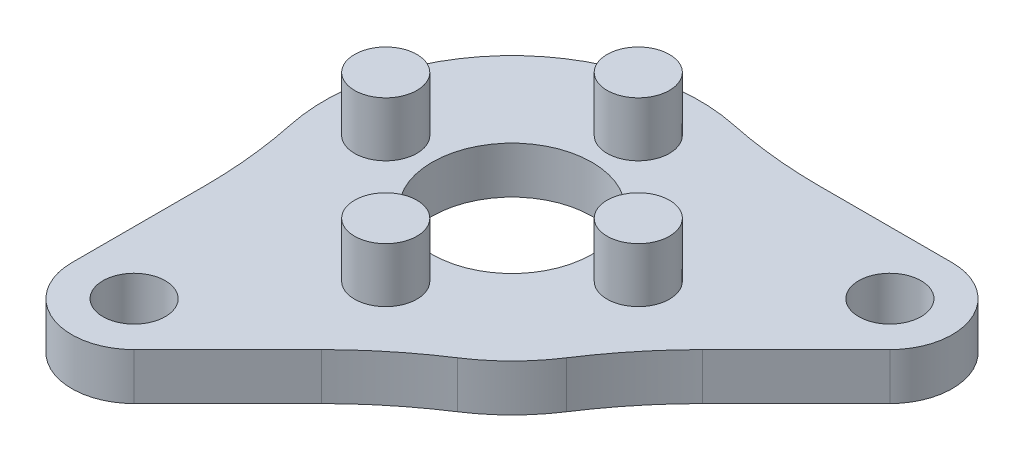
from build123d import *

# Parameters (mm, degrees)
SKETCH1_R           = 2
SKETCH1_R_2         = 5.125
BOSS_EXTRUDE2_DEPTH = 3
SKETCH2_R           = 2
BOSS_EXTRUDE3_DEPTH = 3.5
BOSS_EXTRUDE4_START = -3
SKETCH3_R           = 12
SKETCH3_R_2         = 11.1
BOSS_EXTRUDE4_DEPTH = 3
FILLET1_R           = 30


with BuildPart() as part:
    # Sketch1 → Boss-Extrude2 (new body)
    with BuildSketch(Plane(origin=(0, 0, 0), x_dir=(1, 0, 0), z_dir=(0, 1, 0))):
        with BuildLine():
            Line((0, 11.1), (17.140916293, 11.1))
            ThreePointArc((17.140916293, 11.1), (20.836434423, 8.630733729), (19.969343418, 4.271572875))
            Line((19.969343418, 4.271572875), (-4.271572875, -19.969343418))
            ThreePointArc((-4.271572875, -19.969343418), (-8.630733729, -20.836434423), (-11.1, -17.140916293))
            Line((-11.1, -17.140916293), (-11.1, 0))
            ThreePointArc((-11.1, 0), (-7.848885271, 7.848885271), (0, 11.1))
        make_face()
        with Locations(Location((17.140916293, 7.1, 0), (0, 0, 270))):
            Circle(SKETCH1_R, mode=Mode.SUBTRACT)
        with Locations(Location((-7.1, -17.140916293, 0), (0, 0, 270))):
            Circle(SKETCH1_R, mode=Mode.SUBTRACT)
        with Locations(Location((0, 0, 0), (0, 0, 270))):
            Circle(SKETCH1_R_2, mode=Mode.SUBTRACT)
    extrude(amount=BOSS_EXTRUDE2_DEPTH)

    # Sketch2 → Boss-Extrude3 (add)
    with BuildSketch(Plane(origin=(0, 3, 0), x_dir=(1, 0, 0), z_dir=(0, 1, 0))):
        with Locations(Location((0, -8.1, 0), (0, 0, 270))):
            Circle(SKETCH2_R)
        with Locations(Location((0, 8.1, 0), (0, 0, 90))):
            Circle(SKETCH2_R)
        with Locations(Location((8.1, 0, 0), (0, 0, 90))):
            Circle(SKETCH2_R)
        with Locations(Location((-8.1, 0, 0), (0, 0, 270))):
            Circle(SKETCH2_R)
    extrude(amount=BOSS_EXTRUDE3_DEPTH)

    # Sketch3 → Boss-Extrude4 (add)
    with BuildSketch(Plane(origin=(0, 3, 0), x_dir=(1, 0, 0), z_dir=(0, 1, 0)).offset(BOSS_EXTRUDE4_START)):
        Circle(SKETCH3_R)
        Circle(SKETCH3_R_2, mode=Mode.SUBTRACT)
    extrude(amount=BOSS_EXTRUDE4_DEPTH)

    # Fillet1
    fillet1_edges = [part.edges().sort_by_distance(p)[0] for p in [
        (4.559605246, 1.5, -11.1),
        (-11.1, 1.5, 4.559605246),
        (4.624757482, 1.5, 11.07301306),
        (11.07301306, 1.5, 4.624757482),
    ]]
    fillet(fillet1_edges, radius=FILLET1_R)


solid = part.part
